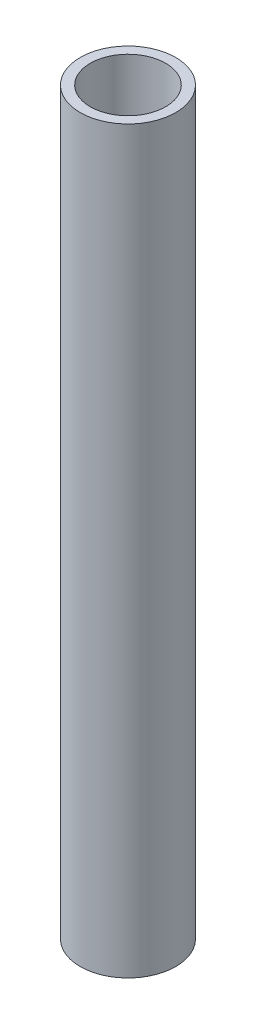
from build123d import *

# Parameters (mm, degrees)
SKETCH1_R           = 24.13
SKETCH1_R_2         = 19.05
BOSS_EXTRUDE1_DEPTH = 186.817


with BuildPart() as part:
    # Sketch1 → Boss-Extrude1 (new, symmetric)
    with BuildSketch(Plane(origin=(0, 0, 0), x_dir=(1, 0, 0), z_dir=(0, 1, 0))):
        with Locations(Location((0, 0, 0), (0, 0, 270))):
            Circle(SKETCH1_R)
        with Locations(Location((0, 0, 0), (0, 0, 270))):
            Circle(SKETCH1_R_2, mode=Mode.SUBTRACT)
    extrude(amount=BOSS_EXTRUDE1_DEPTH, both=True)


solid = part.part
